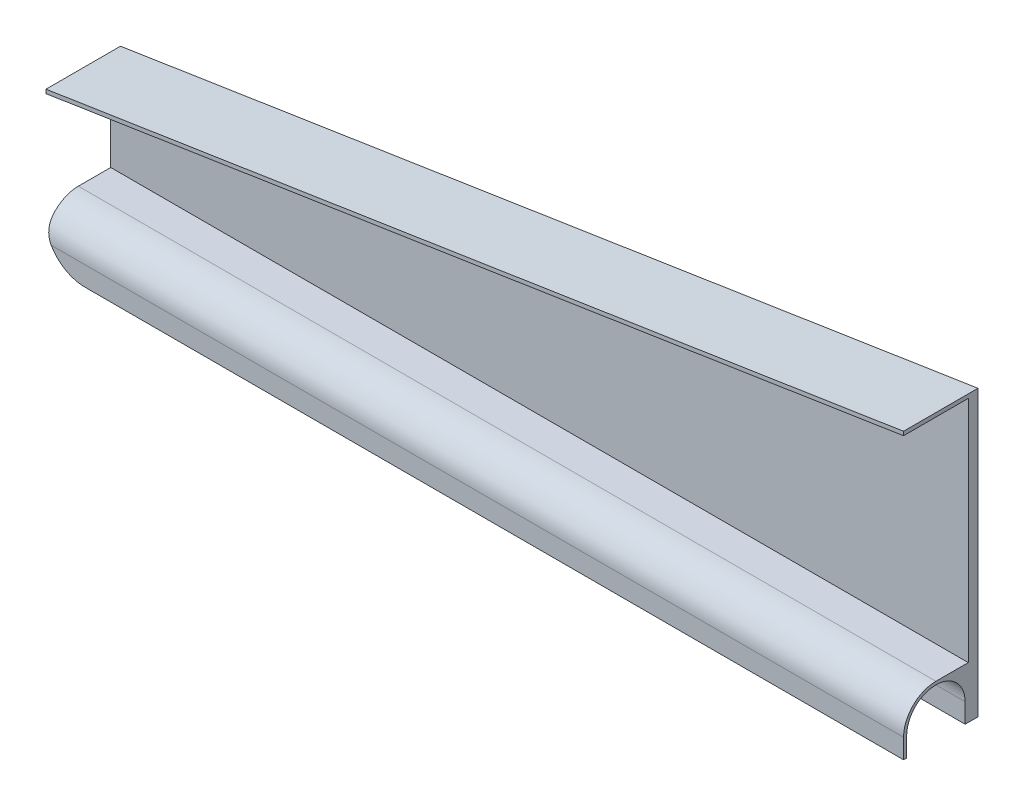
from build123d import *

# Parameters (mm, degrees)
BOSS_EXTRUDE1_DEPTH     = 6.35
BOSS_EXTRUDE7_DEPTH     = 558.8
CUT_EXTRUDE1_DEPTH      = 551.191074589
CUT_EXTRUDE1_DEPTH_BACK = 551.191074589
BOSS_EXTRUDE8_DEPTH     = 42.164
CUT_EXTRUDE2_DEPTH      = 110.49


with BuildPart() as part:
    # Sketch1 → Boss-Extrude1 (new body)
    with BuildSketch(Plane.XY):
        with BuildLine():
            Line((-508.085110878, -46.817945662), (-508.085110878, -168.737945662))
            Line((-508.085110878, -168.737945662), (-508.085110878, -181.437945662))
            ThreePointArc((-508.085110878, -181.437945662), (-500.64562312, -199.398457904), (-482.685110878, -206.837945662))
            Line((-482.685110878, -206.837945662), (50.714889122, -206.837945662))
            Line((50.714889122, -206.837945662), (50.714889122, -21.417945662))
            Line((50.714889122, -21.417945662), (-482.685110878, -21.417945662))
            ThreePointArc((-482.685110878, -21.417945662), (-500.64562312, -28.85743342), (-508.085110878, -46.817945662))
        make_face()
    extrude(amount=BOSS_EXTRUDE1_DEPTH)

    # Sketch3 → Boss-Extrude7 (add)
    with BuildSketch(Plane(origin=(50.714889122, 0, 0), x_dir=(0, 0, -1), z_dir=(1, 0, 0))):
        with BuildLine():
            Line((-6.35, -173.055945662), (-27.432, -173.055945662))
            ThreePointArc((-27.432, -173.055945662), (-42.339225161, -179.230720501), (-48.514, -194.137945662))
            Line((-48.514, -194.137945662), (-48.514, -206.837945662))
            Line((-48.514, -206.837945662), (-46.482, -206.837945662))
            Line((-46.482, -206.837945662), (-46.482, -194.137945662))
            ThreePointArc((-46.482, -194.137945662), (-27.432, -175.087945662), (-8.382, -194.137945662))
            Line((-8.382, -194.137945662), (-8.382, -206.837945662))
            Line((-8.382, -206.837945662), (-6.35, -206.837945662))
            Line((-6.35, -206.837945662), (-6.35, -173.055945662))
        make_face()
    extrude(amount=-BOSS_EXTRUDE7_DEPTH)

    # Sketch4 → Cut-Extrude1 (cut, two sides: drawn at the far end of the back side and taken through both)
    with BuildSketch(Plane.XY.offset(6.35).offset(-CUT_EXTRUDE1_DEPTH_BACK)):
        Polygon((-508.085110878, -107.777945662), (50.714889122, -21.417945662), (-521.431656333, -21.417945662), align=None)
    extrude(amount=CUT_EXTRUDE1_DEPTH + CUT_EXTRUDE1_DEPTH_BACK, mode=Mode.SUBTRACT)

    # Sketch5 → Boss-Extrude8 (add, through all)
    with BuildSketch(Plane.XY.offset(6.35)):
        Polygon((-508.085110878, -107.777945662), (50.714889122, -21.417945662), (50.714889122, -23.957945662), (-508.085110878, -110.317945662), align=None)
    extrude(amount=BOSS_EXTRUDE8_DEPTH)

    # Sketch6 → Cut-Extrude2 (cut)
    with BuildSketch(Plane(origin=(0, 0, 6.35), x_dir=(-1, 0, 0), z_dir=(0, 0, -1))):
        with BuildLine():
            Line((482.685110878, -206.837945662), (508.085110878, -206.837945662))
            Line((508.085110878, -206.837945662), (508.085110878, -181.437945662))
            ThreePointArc((508.085110878, -181.437945662), (500.64562312, -199.398457904), (482.685110878, -206.837945662))
        make_face()
    extrude(amount=-CUT_EXTRUDE2_DEPTH, mode=Mode.SUBTRACT)


solid = part.part
